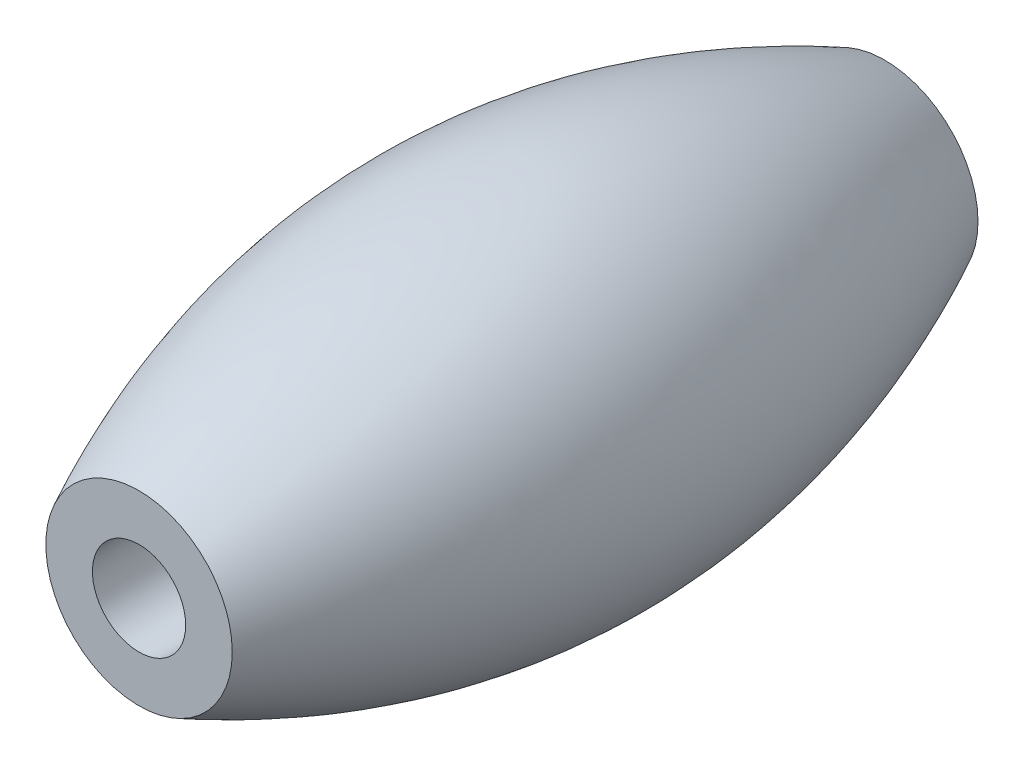
from build123d import *

# Parameters (mm, degrees)
SKETCH2_R          = 4
SKETCH1_R          = 8
SKETCH3_R          = 4
SKETCH4_R          = 2
CUT_EXTRUDE1_DEPTH = 34.941125636


with BuildPart() as part:
    # Sketch2 → Loft1 section 0
    with BuildSketch(Plane.XY.offset(16)):
        Circle(SKETCH2_R)
    # Sketch1 → Loft1 section 1
    with BuildSketch(Plane.XY):
        Circle(SKETCH1_R)
    # Sketch3 → Loft1 section 2
    with BuildSketch(Plane.XY.offset(-16)):
        Circle(SKETCH3_R)
    loft()

    # Sketch4 → Cut-Extrude1 (cut, through all)
    with BuildSketch(Plane.XY.offset(16)):
        Circle(SKETCH4_R)
    extrude(amount=-CUT_EXTRUDE1_DEPTH, mode=Mode.SUBTRACT)


solid = part.part
